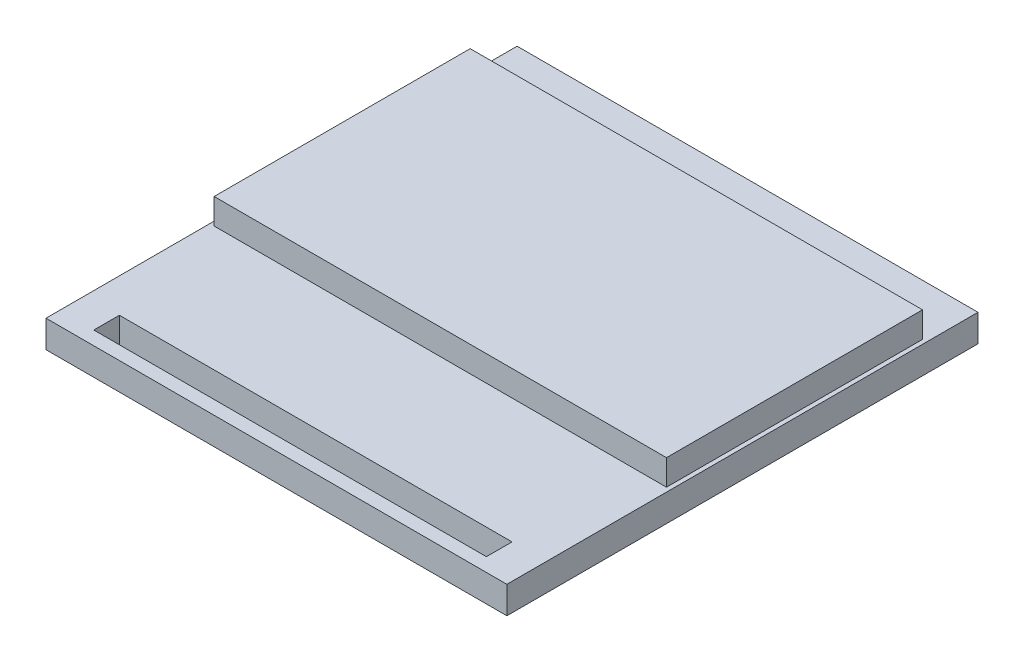
from build123d import *

# Parameters (mm, degrees)
SKETCH_1_W      = 27
SKETCH_1_H      = 27.6
SKETCH_1_W_2    = 23
SKETCH_1_H_2    = 1.5
EXTRUDE_1_DEPTH = 1.6
SKETCH_2_W      = 26.5
SKETCH_2_H      = 15
EXTRUDE_2_DEPTH = 1.5
SKETCH_3_W      = 5.6
SKETCH_3_H      = 12.6
EXTRUDE_3_DEPTH = 2
SKETCH_4_W      = 10.2
SKETCH_4_H      = 2.5
EXTRUDE_4_DEPTH = 2.5


with BuildPart() as part:
    # 草图1 → 凸台-拉伸1 (new body)
    with BuildSketch(Plane(origin=(0, 0, 0), x_dir=(1, 0, 0), z_dir=(0, 1, 0))):
        with Locations((13.5, -13.8)):
            Rectangle(SKETCH_1_W, SKETCH_1_H)
        with Locations((13.5, -26.05)):
            Rectangle(SKETCH_1_W_2, SKETCH_1_H_2, mode=Mode.SUBTRACT)
    extrude(amount=EXTRUDE_1_DEPTH)

    # 草图2 → 凸台-拉伸2 (add)
    with BuildSketch(Plane(origin=(0, 1.6, 0), x_dir=(1, 0, 0), z_dir=(0, 1, 0))):
        with Locations((13.5, -10.5)):
            Rectangle(SKETCH_2_W, SKETCH_2_H)
    extrude(amount=EXTRUDE_2_DEPTH)

    # 草图3 → 凸台-拉伸3 (add)
    with BuildSketch(Plane.XZ):
        with Locations((3.3, 6.9)):
            Rectangle(SKETCH_3_W, SKETCH_3_H)
    extrude(amount=EXTRUDE_3_DEPTH)

    # 草图4 → 凸台-拉伸4 (add)
    with BuildSketch(Plane.XZ):
        with Locations((13.5, 1.25)):
            Rectangle(SKETCH_4_W, SKETCH_4_H)
    extrude(amount=EXTRUDE_4_DEPTH)


solid = part.part
